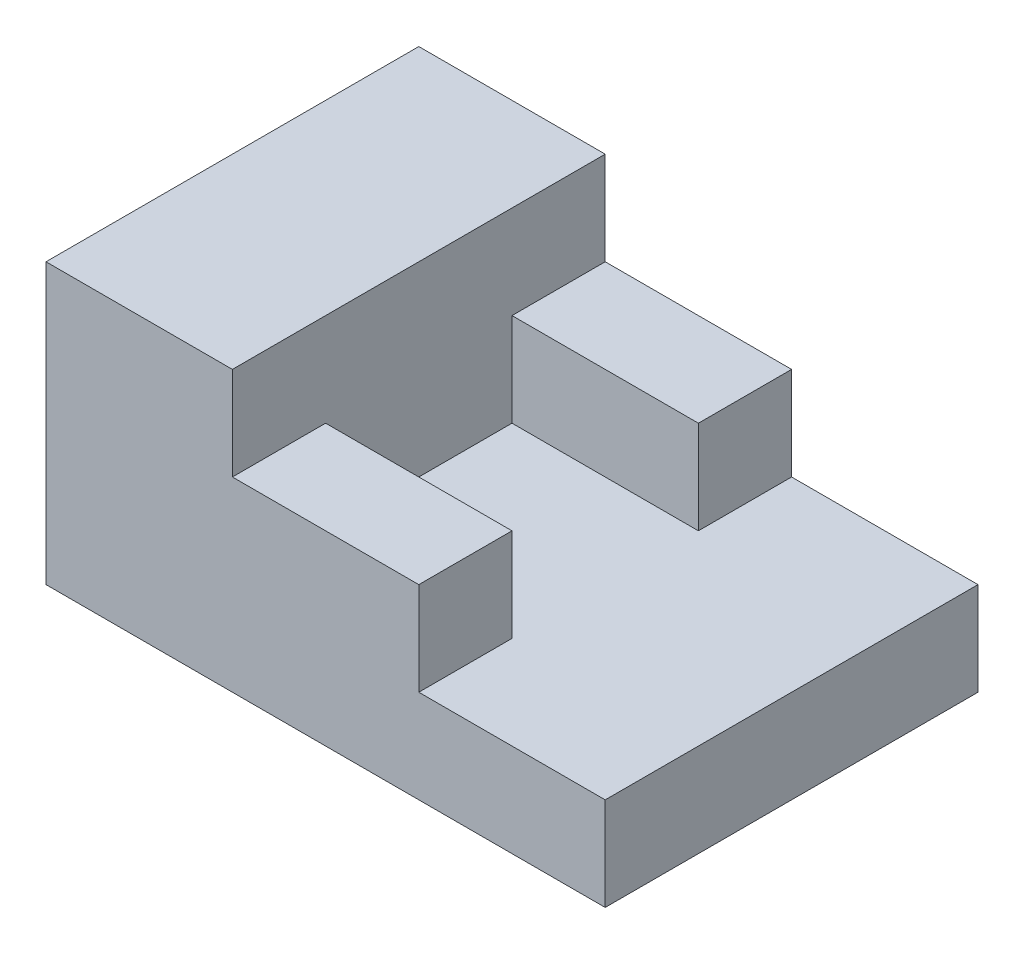
from build123d import *

# Parameters (mm, degrees)
SKETCH_1_W          = 10
SKETCH_1_H          = 15
SKETCH_1_H_2        = 5
EXTRUDE_1_DEPTH     = 20
SKETCH_2_W          = 10
SKETCH_2_H          = 10
CUT_EXTRUDE_1_DEPTH = 5


with BuildPart() as part:
    # 草圖1 → 填料-伸長1 (new body)
    with BuildSketch(Plane.XY):
        with Locations((5, 7.5)):
            Rectangle(SKETCH_1_W, SKETCH_1_H)
        Polygon((10, 10), (10, 0), (20, 0), (20, 5), (20, 10), align=None)
        with Locations((25, 2.5)):
            Rectangle(SKETCH_1_W, SKETCH_1_H_2)
    extrude(amount=-EXTRUDE_1_DEPTH)

    # 草圖2 → 除料-伸長1 (cut)
    with BuildSketch(Plane(origin=(0, 10, 0), x_dir=(1, 0, 0), z_dir=(0, 1, 0))):
        with Locations((15, 10)):
            Rectangle(SKETCH_2_W, SKETCH_2_H)
    extrude(amount=-CUT_EXTRUDE_1_DEPTH, mode=Mode.SUBTRACT)


solid = part.part
